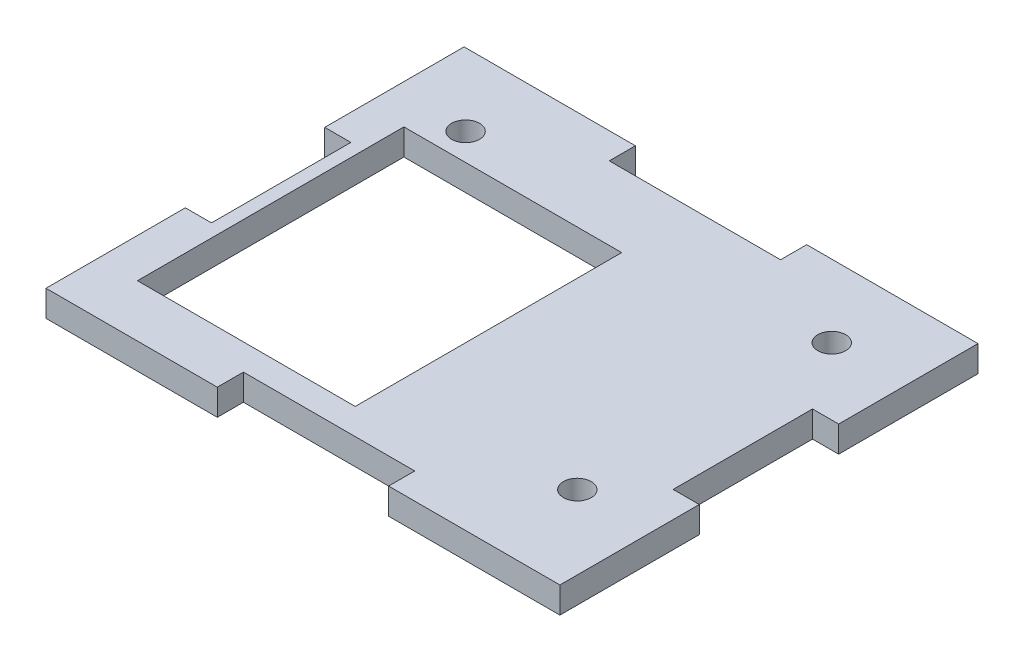
from build123d import *

# Parameters (mm, degrees)
SKETCH1_R           = 1.6
BOSS_EXTRUDE1_DEPTH = 3
SKETCH2_W           = 25
SKETCH2_H           = 30.59
CUT_EXTRUDE1_DEPTH  = 39.14773912


with BuildPart() as part:
    # Sketch1 → Boss-Extrude1 (new body)
    with BuildSketch(Plane(origin=(0, 0, 0), x_dir=(1, 0, 0), z_dir=(0, 1, 0))):
        Polygon((-29.5, 24), (-29.5, 8), (-26.5, 8), (-26.5, -8), (-29.5, -8), (-29.5, -24), (-9.833333333, -24), (-9.833333333, -21), (9.833333333, -21), (9.833333333, -24), (29.5, -24), (29.5, -8), (26.5, -8), (26.5, 8), (29.5, 8), (29.5, 24), (9.833333333, 24), (9.833333333, 21), (-9.833333333, 21), (-9.833333333, 24), align=None)
        with Locations(Location((-21.0185, 15.69, 0), (0, 0, 270))):
            Circle(SKETCH1_R, mode=Mode.SUBTRACT)
        with Locations(Location((21.0185, 15.69, 0), (0, 0, 270))):
            Circle(SKETCH1_R, mode=Mode.SUBTRACT)
        with Locations(Location((21.0185, -13.52, 0), (0, 0, 270))):
            Circle(SKETCH1_R, mode=Mode.SUBTRACT)
    extrude(amount=BOSS_EXTRUDE1_DEPTH)

    # Sketch2 → Cut-Extrude1 (cut, through all)
    with BuildSketch(Plane(origin=(0, 3, 0), x_dir=(1, 0, 0), z_dir=(0, 1, 0))):
        with Locations((-12.5, -2.705)):
            Rectangle(SKETCH2_W, SKETCH2_H)
    extrude(amount=-CUT_EXTRUDE1_DEPTH, mode=Mode.SUBTRACT)


solid = part.part
